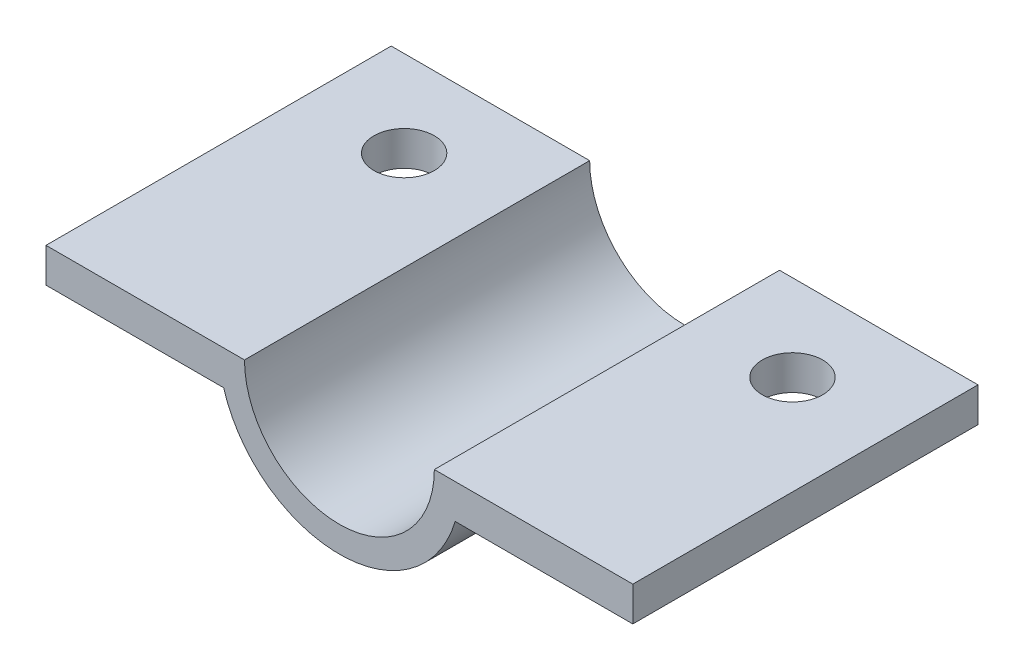
from build123d import *

# Parameters (mm, degrees)
BOSS_EXTRUDE2_DEPTH = 25.4
SKETCH2_R           = 2.2225
CUT_EXTRUDE1_DEPTH  = 25.4


with BuildPart() as part:
    # Sketch1 → Boss-Extrude2 (new body)
    with BuildSketch(Plane.XY):
        with BuildLine():
            Line((8.519418994, 9.778156255), (21.59, 9.778156255))
            Line((21.59, 9.778156255), (21.59, 12.318156255))
            Line((21.59, 12.318156255), (6.985, 12.318156255))
            ThreePointArc((6.985, 12.318156255), (0, 5.333156255), (-6.985, 12.318156255))
            Line((-6.985, 12.318156255), (-21.59, 12.318156255))
            Line((-21.59, 12.318156255), (-21.59, 9.778156255))
            Line((-21.59, 9.778156255), (-8.519418994, 9.778156255))
            ThreePointArc((-8.519418994, 9.778156255), (0, 3.428156255), (8.519418994, 9.778156255))
        make_face()
    extrude(amount=BOSS_EXTRUDE2_DEPTH)

    # Sketch2 → Cut-Extrude1 (cut)
    with BuildSketch(Plane(origin=(0, 12.318156255, 0), x_dir=(1, 0, 0), z_dir=(0, 1, 0))):
        with Locations((-14.2875, -6.35)):
            Circle(SKETCH2_R)
        with Locations((14.2875, -6.35)):
            Circle(SKETCH2_R)
    extrude(amount=-CUT_EXTRUDE1_DEPTH, mode=Mode.SUBTRACT)


solid = part.part
